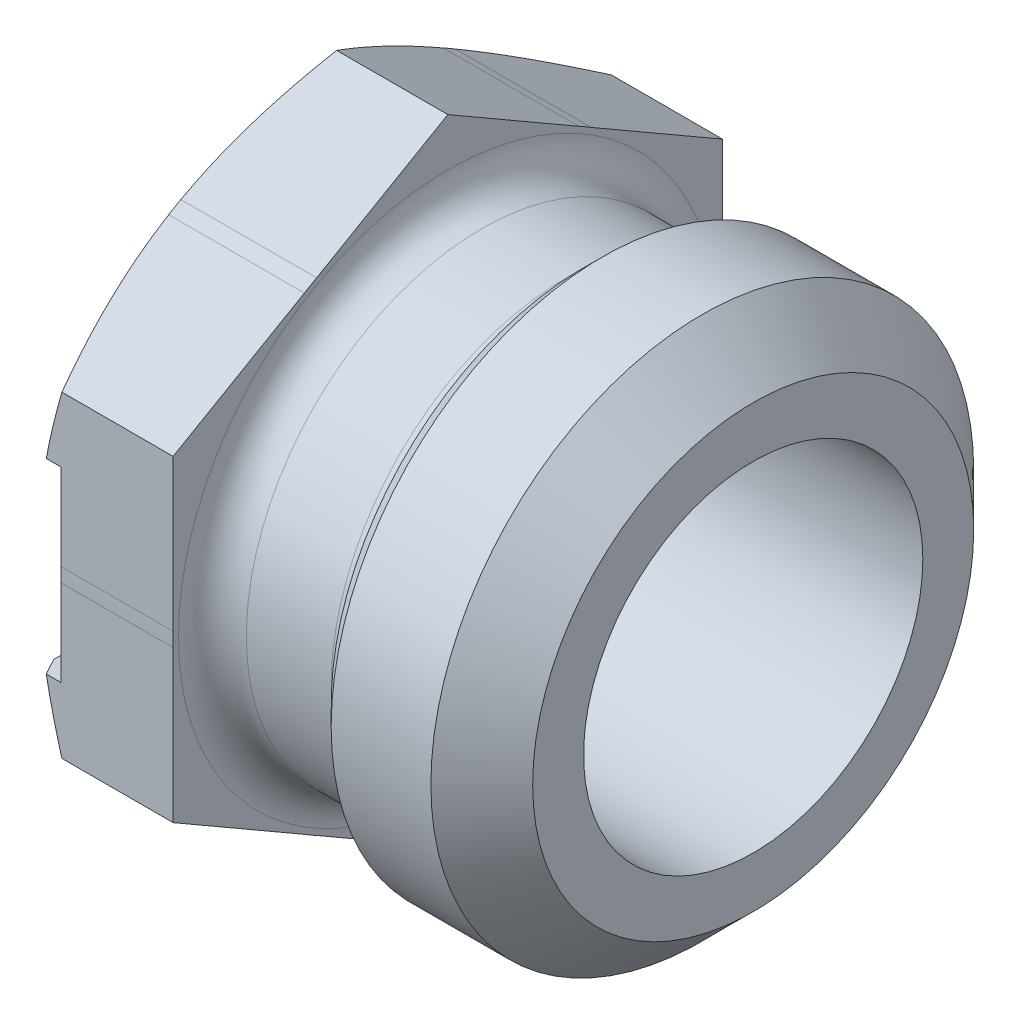
from build123d import *

# Parameters (mm, degrees)
CUT_EXTRUDE_START        = -10
CUT_EXTRUDE_1_DEPTH      = 10
CUT_EXTRUDE_2_DEPTH      = 29.603774074
CUT_EXTRUDE_2_DEPTH_BACK = 29.603774074
SKETCH_3_W               = 1.4
SKETCH_3_H               = 5.5


with BuildPart() as part:
    # Эскиз1 → Повернуть1 (revolve)
    with BuildSketch(Plane(origin=(0, 0, 0), x_dir=(1, 0, 0), z_dir=(0, 1, 0)), mode=Mode.PRIVATE) as revolve_1_sk:
        with BuildLine():
            Line((-8.642542558, -6.5), (-8.642542558, -5))
            Line((-8.642542558, -5), (-21.642542558, -5))
            Line((-21.642542558, -5), (-21.642542558, -8.1))
            Line((-21.642542558, -8.1), (-20.920854721, -9.35))
            Line((-20.920854721, -9.35), (-17.642542558, -9.35))
            Line((-17.642542558, -9.35), (-17.642542558, -7.94))
            ThreePointArc((-17.642542558, -7.94), (-17.349649339, -7.232893219), (-16.642542558, -6.94))
            Line((-16.642542558, -6.94), (-14.142542558, -6.94))
            ThreePointArc((-14.142542558, -6.94), (-13.788989167, -7.086446609), (-13.642542558, -7.44))
            Line((-13.642542558, -7.44), (-13.082542558, -8))
            Line((-13.082542558, -8), (-10.142542558, -8))
            Line((-10.142542558, -8), (-8.642542558, -6.5))
        make_face()
    revolve(revolve_1_sk.sketch.rotate(Axis((24.823529412, 0, 0), (-1, 0, 0)), 180), axis=Axis((24.823529412, 0, 0), (-1, 0, 0)))

    # Эскиз2 → Вырез-Вытянуть1 (cut)
    with BuildSketch(Plane.ZY.offset(21.642542558).offset(CUT_EXTRUDE_START)):
        with BuildLine():
            Line((-8.097337525, 0.207665597), (-8.097337525, 4.675))
            ThreePointArc((-8.097337525, 4.675), (-9.35, 0), (-8.097337525, -4.675))
            Line((-8.097337525, -4.675), (-8.097337525, -0.207665597))
            ThreePointArc((-8.097337525, -0.207665597), (-8.1, 0), (-8.097337525, 0.207665597))
        make_face()
        with BuildLine():
            Line((-3.868825081, 7.116332798), (0, 9.35))
            ThreePointArc((0, 9.35), (-4.675, 8.097337525), (-8.097337525, 4.675))
            Line((-8.097337525, 4.675), (-4.228512445, 6.908667202))
            ThreePointArc((-4.228512445, 6.908667202), (-4.05, 7.014805771), (-3.868825081, 7.116332798))
        make_face()
        with BuildLine():
            ThreePointArc((8.097337525, 4.675), (4.675, 8.097337525), (0, 9.35))
            Line((0, 9.35), (3.868825081, 7.116332798))
            ThreePointArc((3.868825081, 7.116332798), (4.05, 7.014805771), (4.228512445, 6.908667202))
            Line((4.228512445, 6.908667202), (8.097337525, 4.675))
        make_face()
        with BuildLine():
            ThreePointArc((9.35, 0), (9.031406476, 2.419958072), (8.097337525, 4.675))
            Line((8.097337525, 4.675), (8.097337525, 0.207665597))
            ThreePointArc((8.097337525, 0.207665597), (8.099334354, 0.103841332), (8.1, 0))
            ThreePointArc((8.1, 0), (8.099334354, -0.103841332), (8.097337525, -0.207665597))
            Line((8.097337525, -0.207665597), (8.097337525, -4.675))
            ThreePointArc((8.097337525, -4.675), (9.031406476, -2.419958072), (9.35, 0))
        make_face()
        with BuildLine():
            ThreePointArc((0, -9.35), (4.675, -8.097337525), (8.097337525, -4.675))
            Line((8.097337525, -4.675), (4.228512445, -6.908667202))
            ThreePointArc((4.228512445, -6.908667202), (4.05, -7.014805771), (3.868825081, -7.116332798))
            Line((3.868825081, -7.116332798), (0, -9.35))
        make_face()
        with BuildLine():
            Line((-4.228512445, -6.908667202), (-8.097337525, -4.675))
            ThreePointArc((-8.097337525, -4.675), (-4.675, -8.097337525), (0, -9.35))
            Line((0, -9.35), (-3.868825081, -7.116332798))
            ThreePointArc((-3.868825081, -7.116332798), (-4.05, -7.014805771), (-4.228512445, -6.908667202))
        make_face()
    extrude(amount=CUT_EXTRUDE_1_DEPTH, mode=Mode.SUBTRACT)

    # Эскиз3 → Вырез-Вытянуть2 (cut, two sides: drawn at the far end of the back side and taken through both)
    with BuildSketch(Plane(origin=(0, 0, -8.097337525), x_dir=(-1, 0, 0), z_dir=(0, 0, -1)).offset(-CUT_EXTRUDE_2_DEPTH_BACK)):
        with Locations((21.642542558, 0)):
            Rectangle(SKETCH_3_W, SKETCH_3_H)
    extrude(amount=CUT_EXTRUDE_2_DEPTH + CUT_EXTRUDE_2_DEPTH_BACK, mode=Mode.SUBTRACT)


solid = part.part
